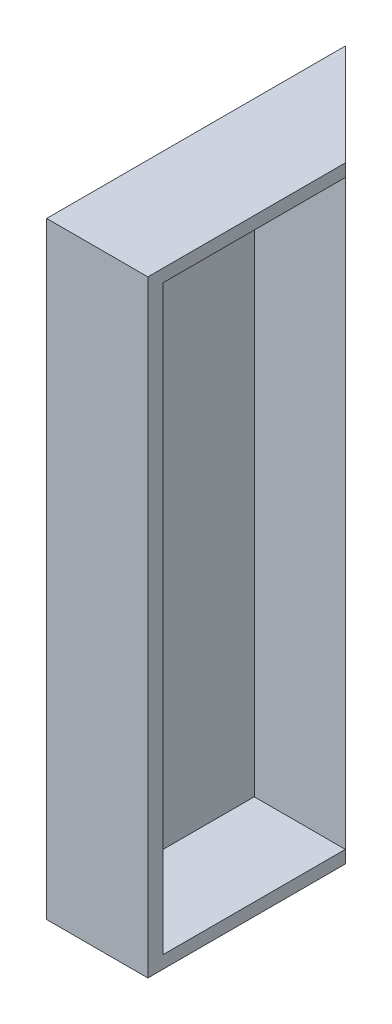
from build123d import *

# Parameters (mm, degrees)
BOSS_EXTRUDE1_DEPTH = 60
SKETCH4_W           = 10
SKETCH4_H           = 1.497685239
BOSS_EXTRUDE2_DEPTH = 60
SKETCH6_W           = 10
SKETCH6_H           = 18.014625213
BOSS_EXTRUDE3_DEPTH = 5
CUT_EXTRUDE1_DEPTH  = 10
SKETCH8_W           = 18.010643645
SKETCH8_H           = 57.5
BOSS_EXTRUDE4_DEPTH = 1


with BuildPart() as part:
    # Sketch2 → Boss-Extrude1 (new body)
    with BuildSketch(Plane(origin=(0, 0, 0), x_dir=(1, 0, 0), z_dir=(0, 1, 0))):
        Polygon((-22, -22), (-22, -12), (-12, -22), align=None)
    extrude(amount=BOSS_EXTRUDE1_DEPTH)



with BuildPart() as body_2:
    # Sketch4 → Boss-Extrude2 (new body)
    with BuildSketch(Plane.XZ):
        with Locations((-17, 40.763467832)):
            Rectangle(SKETCH4_W, SKETCH4_H)
    extrude(amount=-BOSS_EXTRUDE2_DEPTH)


with BuildPart() as part_1:
    add(part.part)

    add(body_2.part)  # Boss-Extrude3 merges body 2
    # Sketch6 → Boss-Extrude3 (add)
    with BuildSketch(Plane(origin=(0, 0, 0), x_dir=(-1, 0, 0), z_dir=(0, -1, 0))):
        with Locations((17, -31.007312607)):
            Rectangle(SKETCH6_W, SKETCH6_H)
    boss_extrude3 = extrude(amount=-BOSS_EXTRUDE3_DEPTH)

    # Mirror1: Boss-Extrude3 across plane
    add(boss_extrude3.mirror(Plane.ZX.offset(30)))

    # Sketch7 → Cut-Extrude1 (cut)
    with BuildSketch(Plane(origin=(-12, 0, 0), x_dir=(0, 0, -1), z_dir=(1, 0, 0))):
        Polygon((-40.014625213, 55), (-22, 55), (-22, 57.5), (-22, 58.75), (-40.014625213, 58.75), (-40.014625213, 57.5), align=None)
        Polygon((-22, 2.5), (-22, 5), (-40.014625213, 5), (-40.010643645, 2.5), (-40.010643645, 1.25), (-22, 1.25), align=None)
    extrude(amount=-CUT_EXTRUDE1_DEPTH, mode=Mode.SUBTRACT)

    # Sketch8 → Boss-Extrude4 (add)
    with BuildSketch(Plane.ZY.offset(22)):
        with Locations((31.005321823, 30)):
            Rectangle(SKETCH8_W, SKETCH8_H)
    extrude(amount=-BOSS_EXTRUDE4_DEPTH)


solid = part_1.part
